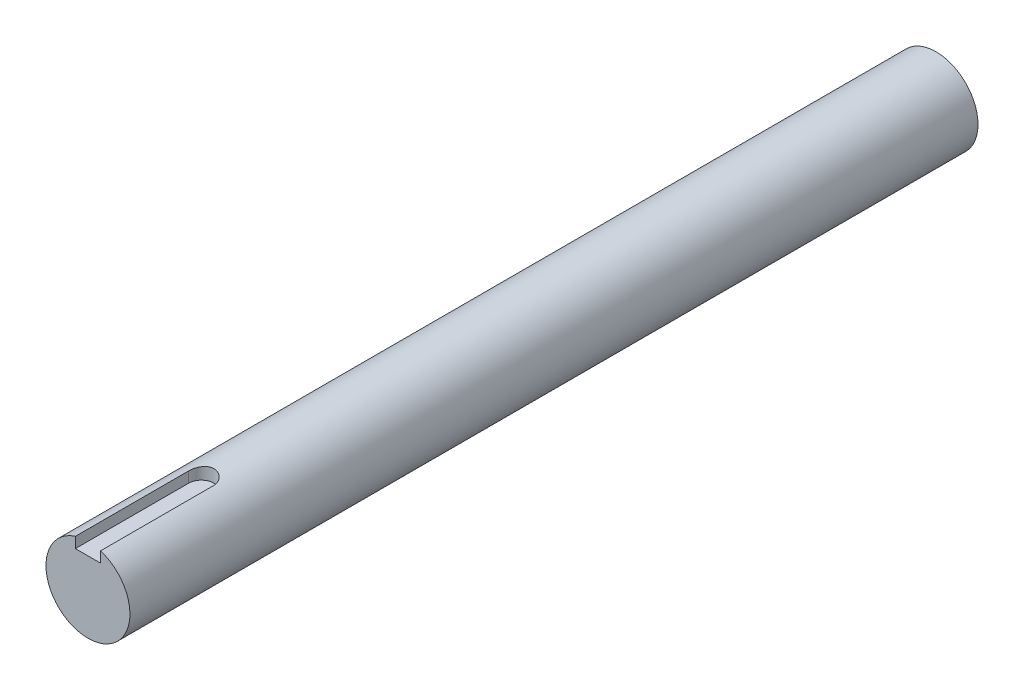
from build123d import *

# Parameters (mm, degrees)
SKETCH1_R           = 5
BOSS_EXTRUDE1_DEPTH = 50.5
CUT_EXTRUDE1_START  = 5
CUT_EXTRUDE1_DEPTH  = 1.5


with BuildPart() as part:
    # Sketch1 → Boss-Extrude1 (new, symmetric)
    with BuildSketch(Plane.XY):
        Circle(SKETCH1_R)
    extrude(amount=BOSS_EXTRUDE1_DEPTH, both=True)

    # Sketch2 → Cut-Extrude1 (cut)
    with BuildSketch(Plane(origin=(0, 0, 0), x_dir=(1, 0, 0), z_dir=(0, 1, 0)).offset(CUT_EXTRUDE1_START)):
        with BuildLine():
            Line((-1.5, -37), (-1.5, -50.5))
            Line((-1.5, -50.5), (1.5, -50.5))
            Line((1.5, -50.5), (1.5, -37))
            ThreePointArc((1.5, -37), (0, -35.5), (-1.5, -37))
        make_face()
    extrude(amount=-CUT_EXTRUDE1_DEPTH, mode=Mode.SUBTRACT)


solid = part.part
